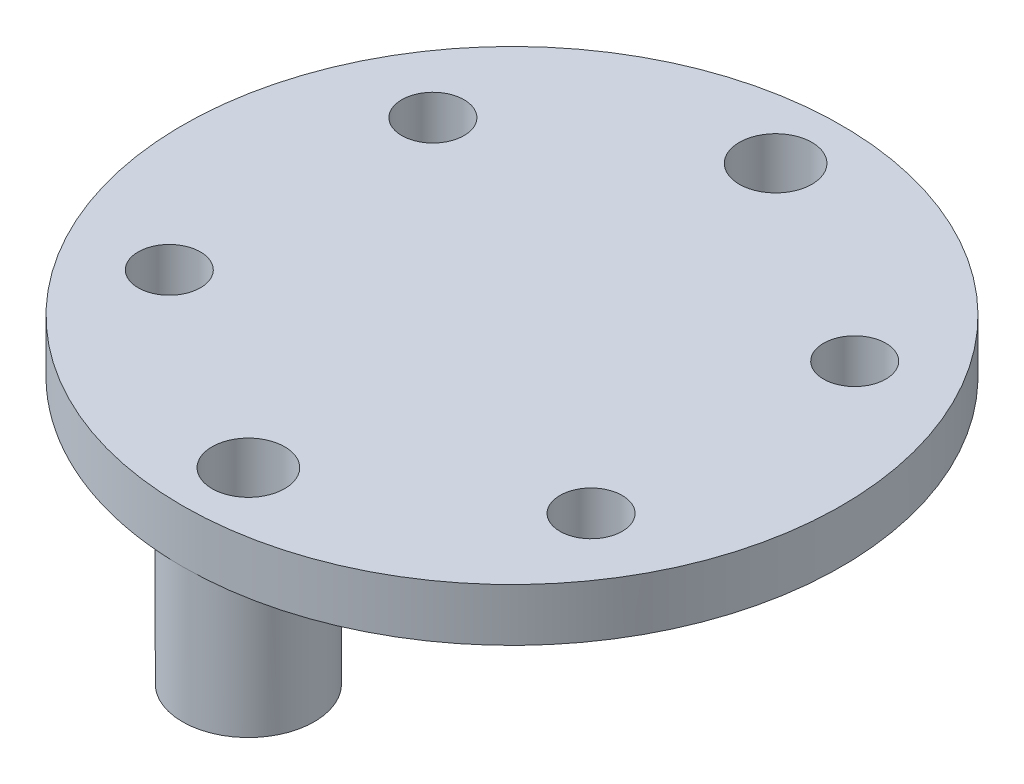
from build123d import *

# Parameters (mm, degrees)
SKETCH1_R           = 15.875
SKETCH1_R_2         = 1.5
SKETCH1_R_3         = 1.75
BOSS_EXTRUDE1_DEPTH = 2.54
BOSS_EXTRUDE2_START = -6.474999999
SKETCH1_3_R         = 3.175
SKETCH1_3_R_2       = 1.75
BOSS_EXTRUDE2_DEPTH = 6.474999999


with BuildPart() as part:
    # Sketch1 → Boss-Extrude1 (new body)
    with BuildSketch(Plane(origin=(0, 0, 0), x_dir=(1, 0, 0), z_dir=(0, 1, 0))):
        Circle(SKETCH1_R)
        with Locations((-10.16, -6.35)):
            Circle(SKETCH1_R_2, mode=Mode.SUBTRACT)
        with Locations((10.16, -6.35)):
            Circle(SKETCH1_R_2, mode=Mode.SUBTRACT)
        with Locations((-10.16, 6.35)):
            Circle(SKETCH1_R_2, mode=Mode.SUBTRACT)
        with Locations((10.16, 6.35)):
            Circle(SKETCH1_R_2, mode=Mode.SUBTRACT)
        with Locations((0, -12.7)):
            Circle(SKETCH1_R_3, mode=Mode.SUBTRACT)
        with Locations((0, 12.7)):
            Circle(SKETCH1_R_3, mode=Mode.SUBTRACT)
    extrude(amount=BOSS_EXTRUDE1_DEPTH)

    # Sketch1<3> → Boss-Extrude2 (add)
    # profile 1 of 2: a face of its own
    with BuildSketch(Plane(origin=(0, 0, 0), x_dir=(1, 0, 0), z_dir=(0, 1, 0)).offset(BOSS_EXTRUDE2_START)):
        with Locations((0, 12.7)):
            Circle(SKETCH1_3_R)
        with Locations((0, 12.7)):
            Circle(SKETCH1_3_R_2, mode=Mode.SUBTRACT)
    # profile 2 of 2: a face of its own
    with BuildSketch(Plane(origin=(0, 0, 0), x_dir=(1, 0, 0), z_dir=(0, 1, 0)).offset(BOSS_EXTRUDE2_START)):
        with Locations((0, -12.7)):
            Circle(SKETCH1_3_R)
        with Locations((0, -12.7)):
            Circle(SKETCH1_3_R_2, mode=Mode.SUBTRACT)
    extrude(amount=BOSS_EXTRUDE2_DEPTH)


solid = part.part
